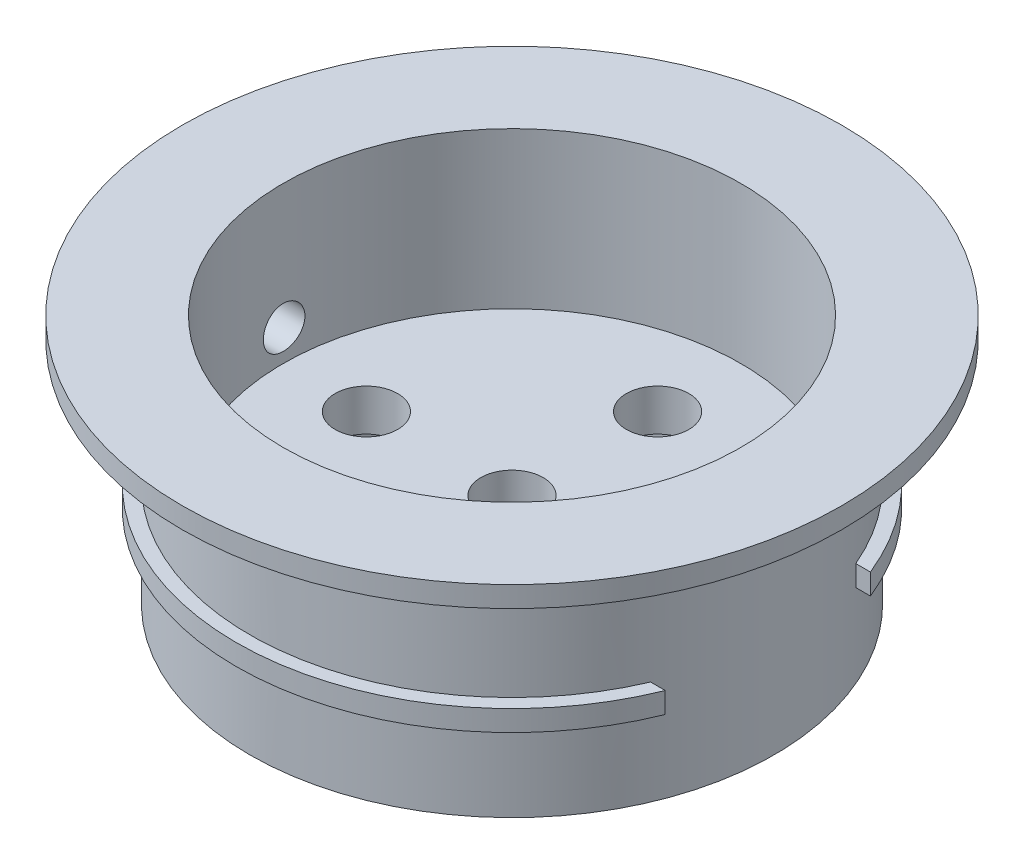
from build123d import *

# Parameters (mm, degrees)
SKETCH_1_R          = 15.85
EXTRUDE_1_DEPTH     = 12
SKETCH_2_R          = 10.1
CUT_EXTRUDE_1_DEPTH = 2.5
SKETCH_3_R          = 11
CUT_EXTRUDE_2_DEPTH = 7.5
SKETCH_4_R          = 1.5
CUT_EXTRUDE_3_DEPTH = 6
EXTRUDE_2_DEPTH     = 1
SKETCH_7_R          = 1
CUT_EXTRUDE_4_DEPTH = 16


with BuildPart() as part:
    # 草图1 → 凸台-拉伸1 (new body)
    with BuildSketch(Plane(origin=(0, 0, 0), x_dir=(1, 0, 0), z_dir=(0, 1, 0))):
        with Locations(Location((0, 0, 0), (0, 0, 270))):
            Circle(SKETCH_1_R)
    extrude(amount=EXTRUDE_1_DEPTH)

    # 草图2 → 切除-拉伸1 (cut)
    with BuildSketch(Plane.XZ):
        with Locations(Location((0, 0, 0), (0, 0, 270))):
            Circle(SKETCH_2_R)
    extrude(amount=-CUT_EXTRUDE_1_DEPTH, mode=Mode.SUBTRACT)

    # 草图3 → 切除-拉伸2 (cut)
    with BuildSketch(Plane(origin=(0, 12, 0), x_dir=(1, 0, 0), z_dir=(0, 1, 0))):
        with Locations(Location((0, 0, 0), (0, 0, 270))):
            Circle(SKETCH_3_R)
    extrude(amount=-CUT_EXTRUDE_2_DEPTH, mode=Mode.SUBTRACT)

    # 草图4 → 切除-拉伸3 (cut)
    with BuildSketch(Plane.XZ.offset(-2.5)):
        with Locations(Location((0, 7, 0), (0, 0, 270))):
            Circle(SKETCH_4_R)
        with Locations(Location((7, 0, 0), (0, 0, 270))):
            Circle(SKETCH_4_R)
        with Locations(Location((0, -7, 0), (0, 0, 270))):
            Circle(SKETCH_4_R)
        with Locations(Location((-7, 0, 0), (0, 0, 270))):
            Circle(SKETCH_4_R)
        with Locations(Location((0, 0, 0), (0, 0, 270))):
            Circle(SKETCH_4_R)
    extrude(amount=-CUT_EXTRUDE_3_DEPTH, mode=Mode.SUBTRACT)

    # 草图5 → 切除-旋转1 (revolve, cut)
    with BuildSketch(Plane(origin=(0, 0, 0), x_dir=(0, 0, -1), z_dir=(1, 0, 0)), mode=Mode.PRIVATE) as cut_revolve_1_sk:
        Polygon((-15.35, 11), (-12.6, 9.41228676), (-12.6, 0), (-15.85, 0), (-15.85, 11), align=None)
    revolve(cut_revolve_1_sk.sketch.rotate(Axis((0, -0.5, 0), (0, 1, 0)), 180), axis=Axis((0, -0.5, 0), (0, 1, 0)), mode=Mode.SUBTRACT)

    # 草图6 → 凸台-拉伸2 (add)
    with BuildSketch(Plane(origin=(0, 4, 0), x_dir=(1, 0, 0), z_dir=(0, 1, 0))):
        with BuildLine():
            Line((11.485757101, 4.932279778), (12.297768749, 4.932279778))
            ThreePointArc((12.297768749, 4.932279778), (-13.25, 0), (12.297768749, -4.932279778))
            Line((12.297768749, -4.932279778), (11.485757101, -4.932279778))
            ThreePointArc((11.485757101, -4.932279778), (-12.5, 0), (11.485757101, 4.932279778))
        make_face()
    extrude(amount=EXTRUDE_2_DEPTH)

    # 草图7 → 切除-拉伸4 (cut)
    with BuildSketch(Plane(origin=(0, 0, 0), x_dir=(0, 0, -1), z_dir=(1, 0, 0))):
        with Locations((0, 6)):
            Circle(SKETCH_7_R)
    extrude(amount=-CUT_EXTRUDE_4_DEPTH, mode=Mode.SUBTRACT)


solid = part.part
